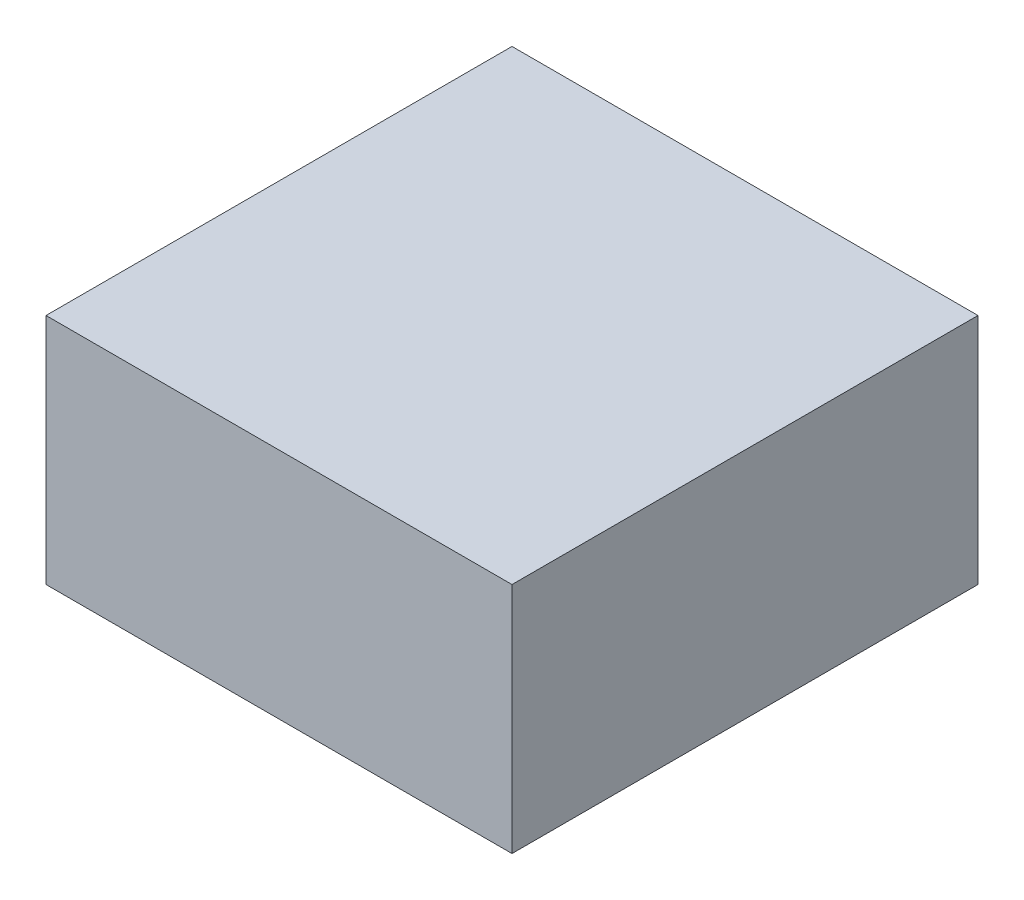
from build123d import *

# Parameters (mm, degrees)
SKETCH1_W           = 100
SKETCH1_H           = 100
BOSS_EXTRUDE1_DEPTH = 50


with BuildPart() as part:
    # Sketch1 → Boss-Extrude1 (new body)
    with BuildSketch(Plane(origin=(0, 0, 0), x_dir=(1, 0, 0), z_dir=(0, 1, 0))):
        with Locations((0, 50)):
            Rectangle(SKETCH1_W, SKETCH1_H)
    extrude(amount=BOSS_EXTRUDE1_DEPTH)


solid = part.part
